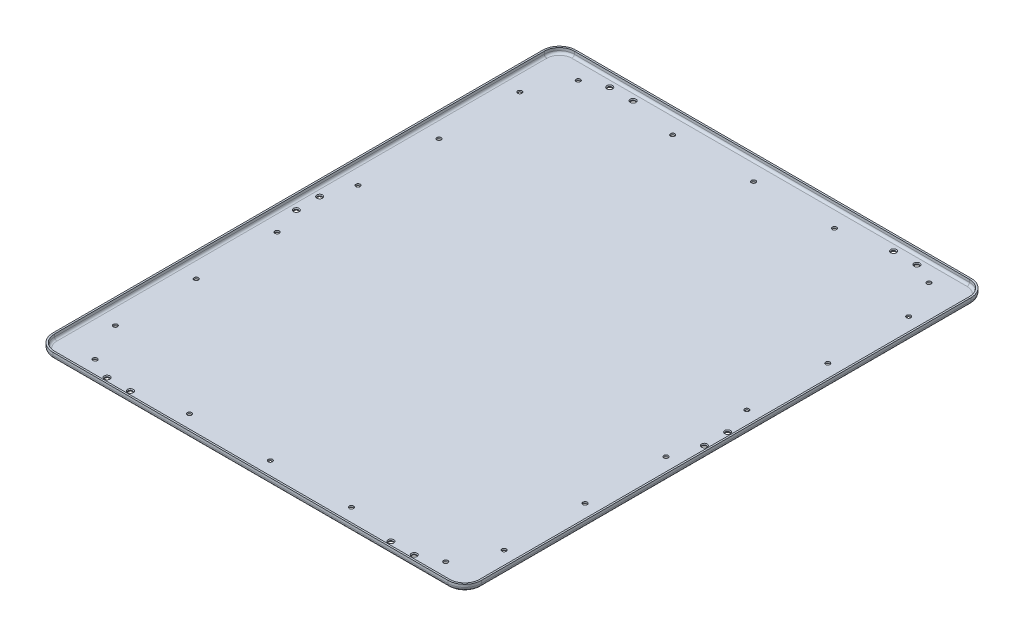
from build123d import *
from OCP.BRepFilletAPI import BRepFilletAPI_MakeChamfer

# Parameters (mm, degrees)
SKETCH1_W          = 403.606
SKETCH1_H          = 492.76
EXTRUDE1_DEPTH     = 6.35
FILLET1_R          = 15.748
FILLET2_R          = 3.81
SHELL1_T           = -1.6002
SKETCH4_R          = 2.0447
CUT_EXTRUDE2_DEPTH = 530.301320194
SKETCH5_R          = 2.0447
CUT_EXTRUDE4_DEPTH = 530.301320194
CHAMFER1_SIZE      = 0.8128
CHAMFER1_SIZE2     = 0.658192462


with BuildPart() as part:
    # Sketch1 → Extrude1 (new body)
    with BuildSketch(Plane(origin=(0, 0, 0), x_dir=(1, 0, 0), z_dir=(0, 1, 0))):
        with Locations((0, 242.9002)):
            Rectangle(SKETCH1_W, SKETCH1_H)
    extrude(amount=EXTRUDE1_DEPTH)

    # Fillet1
    fillet1_edges = [part.edges().sort_by_distance(p)[0] for p in [
        (-201.803, 3.175, -489.2802),
        (201.803, 3.175, -489.2802),
        (201.803, 3.175, 3.4798),
        (-201.803, 3.175, 3.4798),
    ]]
    fillet(fillet1_edges, radius=FILLET1_R)

    # Fillet2
    fillet2_edges = [part.edges().sort_by_distance(p)[0] for p in [
        (0, 0, 3.4798),
        (-201.803, 0, -242.9002),
        (0, 0, -489.2802),
        (201.803, 0, -242.9002),
        (197.19051759, 0, -1.13268241),
        (197.19051759, 0, -484.66771759),
        (-197.19051759, 0, -484.66771759),
        (-197.19051759, 0, -1.13268241),
    ]]
    fillet(fillet2_edges, radius=FILLET2_R)

    # Shell1
    shell1_openings = [part.faces().sort_by_distance(p)[0] for p in [
        (0, 6.35, -242.9002),
    ]]
    offset(amount=SHELL1_T, openings=shell1_openings, kind=Kind.INTERSECTION)

    # Sketch4 → Cut-Extrude2 (cut, through all)
    with BuildSketch(Plane(origin=(0, 0, 0), x_dir=(1, 0, 0), z_dir=(0, 1, 0))):
        with Locations(Location((183.134, 204.8002, 0), (0, 0, 270))):
            Circle(SKETCH4_R)
        with Locations(Location((0, 15.367, 0), (0, 0, 270))):
            Circle(SKETCH4_R)
        with Locations(Location((183.134, 128.6002, 0), (0, 0, 270))):
            Circle(SKETCH4_R)
        with Locations(Location((183.134, 433.4002, 0), (0, 0, 270))):
            Circle(SKETCH4_R)
        with Locations(Location((183.134, 281.0002, 0), (0, 0, 270))):
            Circle(SKETCH4_R)
        with Locations(Location((183.134, 357.2002, 0), (0, 0, 270))):
            Circle(SKETCH4_R)
        with Locations(Location((-183.134, 357.2002, 0), (0, 0, 90))):
            Circle(SKETCH4_R)
        with Locations(Location((-183.134, 281.0002, 0), (0, 0, 90))):
            Circle(SKETCH4_R)
        with Locations(Location((183.134, 52.4002, 0), (0, 0, 90))):
            Circle(SKETCH4_R)
        with Locations(Location((-183.134, 128.6002, 0), (0, 0, 90))):
            Circle(SKETCH4_R)
        with Locations(Location((-183.134, 204.8002, 0), (0, 0, 90))):
            Circle(SKETCH4_R)
        with Locations(Location((165.1, 15.367, 0), (0, 0, 270))):
            Circle(SKETCH4_R)
        with Locations(Location((-183.134, 52.4002, 0), (0, 0, 270))):
            Circle(SKETCH4_R)
        with Locations(Location((-183.134, 433.4002, 0), (0, 0, 90))):
            Circle(SKETCH4_R)
        with Locations(Location((-165.1, 470.4334, 0), (0, 0, 90))):
            Circle(SKETCH4_R)
        with Locations(Location((-76.2, 470.4334, 0), (0, 0, 90))):
            Circle(SKETCH4_R)
        with Locations(Location((76.2, 15.367, 0), (0, 0, 270))):
            Circle(SKETCH4_R)
        with Locations(Location((76.2, 470.4334, 0), (0, 0, 90))):
            Circle(SKETCH4_R)
        with Locations(Location((165.1, 470.4334, 0), (0, 0, 90))):
            Circle(SKETCH4_R)
        with Locations(Location((-76.2, 15.367, 0), (0, 0, 270))):
            Circle(SKETCH4_R)
        with Locations(Location((-165.1, 15.367, 0), (0, 0, 270))):
            Circle(SKETCH4_R)
        with Locations(Location((0, 470.4334, 0), (0, 0, 90))):
            Circle(SKETCH4_R)
    extrude(amount=CUT_EXTRUDE2_DEPTH, mode=Mode.SUBTRACT)

    # Sketch5 → Cut-Extrude4 (cut, through all)
    with BuildSketch(Plane(origin=(0, 0, 0), x_dir=(1, 0, 0), z_dir=(0, 1, 0))):
        with Locations(Location((122.6566, 6.1722, 0), (0, 0, 90))):
            Circle(SKETCH5_R)
        with Locations(Location((144.653, 6.1722, 0), (0, 0, 270))):
            Circle(SKETCH5_R)
        with Locations(Location((-122.6566, 6.1722, 0), (0, 0, 270))):
            Circle(SKETCH5_R)
        with Locations(Location((-144.653, 6.1722, 0), (0, 0, 90))):
            Circle(SKETCH5_R)
        with Locations(Location((-144.653, 479.6282, 0), (0, 0, 270))):
            Circle(SKETCH5_R)
        with Locations(Location((-122.6566, 479.6282, 0), (0, 0, 90))):
            Circle(SKETCH5_R)
        with Locations(Location((122.6566, 479.6282, 0), (0, 0, 270))):
            Circle(SKETCH5_R)
        with Locations(Location((144.653, 479.6282, 0), (0, 0, 90))):
            Circle(SKETCH5_R)
        with Locations(Location((-192.151, 231.902, 0), (0, 0, 270))):
            Circle(SKETCH5_R)
        with Locations(Location((-192.151, 253.8984, 0), (0, 0, 90))):
            Circle(SKETCH5_R)
        with Locations(Location((192.151, 253.8984, 0), (0, 0, 270))):
            Circle(SKETCH5_R)
        with Locations(Location((192.151, 231.902, 0), (0, 0, 90))):
            Circle(SKETCH5_R)
    extrude(amount=CUT_EXTRUDE4_DEPTH, mode=Mode.SUBTRACT)

    # Chamfer1: one chamfer whose edges measure the first distance from different faces: ONE call of the kernel's chamfer builder (chamfer() names one face for all edges)
    chamfer1_edges_1 = [part.edges().sort_by_distance(p)[0] for p in [
        (144.653, 1.6002, -8.2169),
    ]]
    chamfer1_side_1 = [part.faces().sort_by_distance(p)[0] for p in [
        (144.653, 0.8001, -8.2169),
    ]]
    chamfer1_edges_2 = [part.edges().sort_by_distance(p)[0] for p in [
        (122.6566, 1.6002, -4.1275),
    ]]
    chamfer1_side_2 = [part.faces().sort_by_distance(p)[0] for p in [
        (122.6566, 0.8001, -4.1275),
    ]]
    chamfer1_edges_3 = [part.edges().sort_by_distance(p)[0] for p in [
        (-122.6566, 1.6002, -8.2169),
    ]]
    chamfer1_side_3 = [part.faces().sort_by_distance(p)[0] for p in [
        (-122.6566, 0.8001, -8.2169),
    ]]
    chamfer1_edges_4 = [part.edges().sort_by_distance(p)[0] for p in [
        (-144.653, 1.6002, -4.1275),
    ]]
    chamfer1_side_4 = [part.faces().sort_by_distance(p)[0] for p in [
        (-144.653, 0.8001, -4.1275),
    ]]
    chamfer1_edges_5 = [part.edges().sort_by_distance(p)[0] for p in [
        (-144.653, 1.6002, -481.6729),
    ]]
    chamfer1_side_5 = [part.faces().sort_by_distance(p)[0] for p in [
        (-144.653, 0.8001, -481.6729),
    ]]
    chamfer1_edges_6 = [part.edges().sort_by_distance(p)[0] for p in [
        (-122.6566, 1.6002, -477.5835),
    ]]
    chamfer1_side_6 = [part.faces().sort_by_distance(p)[0] for p in [
        (-122.6566, 0.8001, -477.5835),
    ]]
    chamfer1_edges_7 = [part.edges().sort_by_distance(p)[0] for p in [
        (122.6566, 1.6002, -481.6729),
    ]]
    chamfer1_side_7 = [part.faces().sort_by_distance(p)[0] for p in [
        (122.6566, 0.8001, -481.6729),
    ]]
    chamfer1_edges_8 = [part.edges().sort_by_distance(p)[0] for p in [
        (144.653, 1.6002, -477.5835),
    ]]
    chamfer1_side_8 = [part.faces().sort_by_distance(p)[0] for p in [
        (144.653, 0.8001, -477.5835),
    ]]
    chamfer1_edges_9 = [part.edges().sort_by_distance(p)[0] for p in [
        (-192.151, 1.6002, -233.9467),
    ]]
    chamfer1_side_9 = [part.faces().sort_by_distance(p)[0] for p in [
        (-192.151, 0.8001, -233.9467),
    ]]
    chamfer1_edges_10 = [part.edges().sort_by_distance(p)[0] for p in [
        (-192.151, 1.6002, -251.8537),
    ]]
    chamfer1_side_10 = [part.faces().sort_by_distance(p)[0] for p in [
        (-192.151, 0.8001, -251.8537),
    ]]
    chamfer1_edges_11 = [part.edges().sort_by_distance(p)[0] for p in [
        (192.151, 1.6002, -255.9431),
    ]]
    chamfer1_side_11 = [part.faces().sort_by_distance(p)[0] for p in [
        (192.151, 0.8001, -255.9431),
    ]]
    chamfer1_edges_12 = [part.edges().sort_by_distance(p)[0] for p in [
        (192.151, 1.6002, -229.8573),
    ]]
    chamfer1_side_12 = [part.faces().sort_by_distance(p)[0] for p in [
        (192.151, 0.8001, -229.8573),
    ]]
    chamfer1 = BRepFilletAPI_MakeChamfer(part.part.solid().wrapped)
    for e in chamfer1_edges_1:
        chamfer1.Add(CHAMFER1_SIZE, CHAMFER1_SIZE2, e.wrapped, chamfer1_side_1[0].wrapped)  # the first distance lies on this face
    for e in chamfer1_edges_2:
        chamfer1.Add(CHAMFER1_SIZE, CHAMFER1_SIZE2, e.wrapped, chamfer1_side_2[0].wrapped)  # the first distance lies on this face
    for e in chamfer1_edges_3:
        chamfer1.Add(CHAMFER1_SIZE, CHAMFER1_SIZE2, e.wrapped, chamfer1_side_3[0].wrapped)  # the first distance lies on this face
    for e in chamfer1_edges_4:
        chamfer1.Add(CHAMFER1_SIZE, CHAMFER1_SIZE2, e.wrapped, chamfer1_side_4[0].wrapped)  # the first distance lies on this face
    for e in chamfer1_edges_5:
        chamfer1.Add(CHAMFER1_SIZE, CHAMFER1_SIZE2, e.wrapped, chamfer1_side_5[0].wrapped)  # the first distance lies on this face
    for e in chamfer1_edges_6:
        chamfer1.Add(CHAMFER1_SIZE, CHAMFER1_SIZE2, e.wrapped, chamfer1_side_6[0].wrapped)  # the first distance lies on this face
    for e in chamfer1_edges_7:
        chamfer1.Add(CHAMFER1_SIZE, CHAMFER1_SIZE2, e.wrapped, chamfer1_side_7[0].wrapped)  # the first distance lies on this face
    for e in chamfer1_edges_8:
        chamfer1.Add(CHAMFER1_SIZE, CHAMFER1_SIZE2, e.wrapped, chamfer1_side_8[0].wrapped)  # the first distance lies on this face
    for e in chamfer1_edges_9:
        chamfer1.Add(CHAMFER1_SIZE, CHAMFER1_SIZE2, e.wrapped, chamfer1_side_9[0].wrapped)  # the first distance lies on this face
    for e in chamfer1_edges_10:
        chamfer1.Add(CHAMFER1_SIZE, CHAMFER1_SIZE2, e.wrapped, chamfer1_side_10[0].wrapped)  # the first distance lies on this face
    for e in chamfer1_edges_11:
        chamfer1.Add(CHAMFER1_SIZE, CHAMFER1_SIZE2, e.wrapped, chamfer1_side_11[0].wrapped)  # the first distance lies on this face
    for e in chamfer1_edges_12:
        chamfer1.Add(CHAMFER1_SIZE, CHAMFER1_SIZE2, e.wrapped, chamfer1_side_12[0].wrapped)  # the first distance lies on this face
    add(Compound.cast(chamfer1.Shape()), mode=Mode.REPLACE)


solid = part.part
